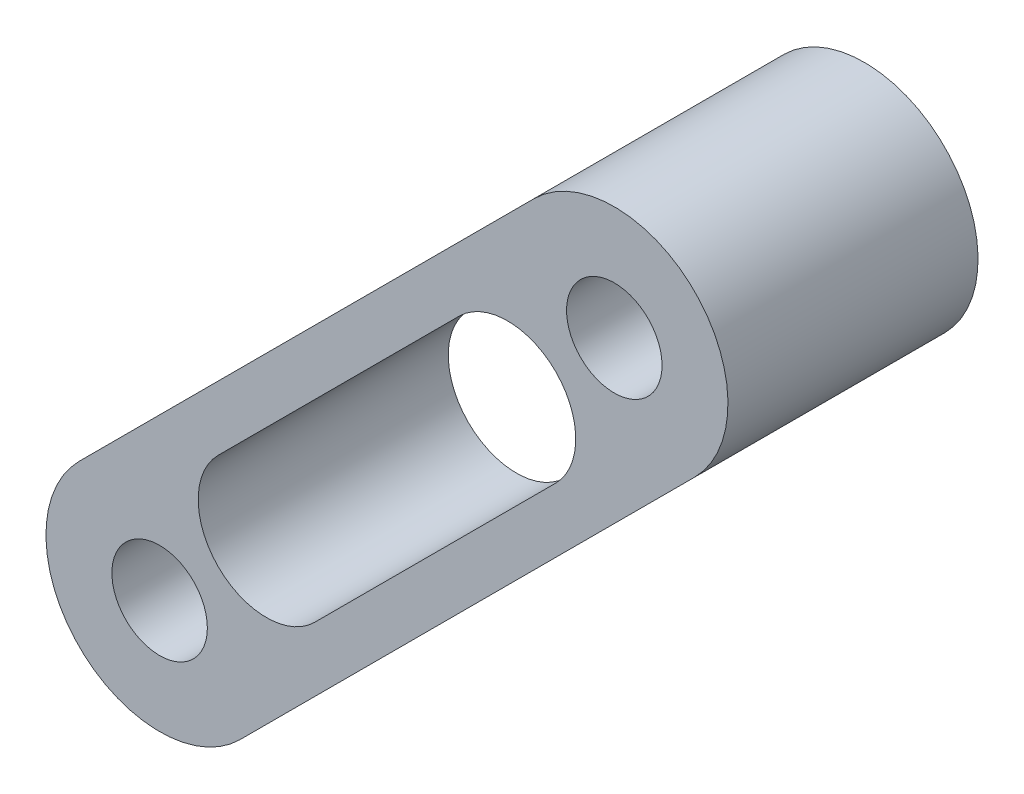
from build123d import *

# Parameters (mm, degrees)
ESQUISSE1_R        = 2.1
BOSS_EXTRU_1_DEPTH = 11


with BuildPart() as part:
    # Esquisse1 → Boss.-Extru.1 (new body)
    with BuildSketch(Plane.XY):
        with BuildLine():
            Line((-23.535533906, 3.535533906), (-3.535533906, 23.535533906))
            ThreePointArc((-3.535533906, 23.535533906), (3.535533906, 23.535533906), (3.535533906, 16.464466094))
            Line((3.535533906, 16.464466094), (-16.464466094, -3.535533906))
            ThreePointArc((-16.464466094, -3.535533906), (-23.535533906, -3.535533906), (-23.535533906, 3.535533906))
        make_face()
        with Locations((-20, 0)):
            Circle(ESQUISSE1_R, mode=Mode.SUBTRACT)
        with Locations((0, 20)):
            Circle(ESQUISSE1_R, mode=Mode.SUBTRACT)
        with BuildLine():
            Line((-17.424621202, 6.818019485), (-6.818019485, 17.424621202))
            ThreePointArc((-6.818019485, 17.424621202), (-2.575378798, 17.424621202), (-2.575378798, 13.181980515))
            Line((-2.575378798, 13.181980515), (-13.181980515, 2.575378798))
            ThreePointArc((-13.181980515, 2.575378798), (-17.424621202, 2.575378798), (-17.424621202, 6.818019485))
        make_face(mode=Mode.SUBTRACT)
    extrude(amount=BOSS_EXTRU_1_DEPTH)


solid = part.part
